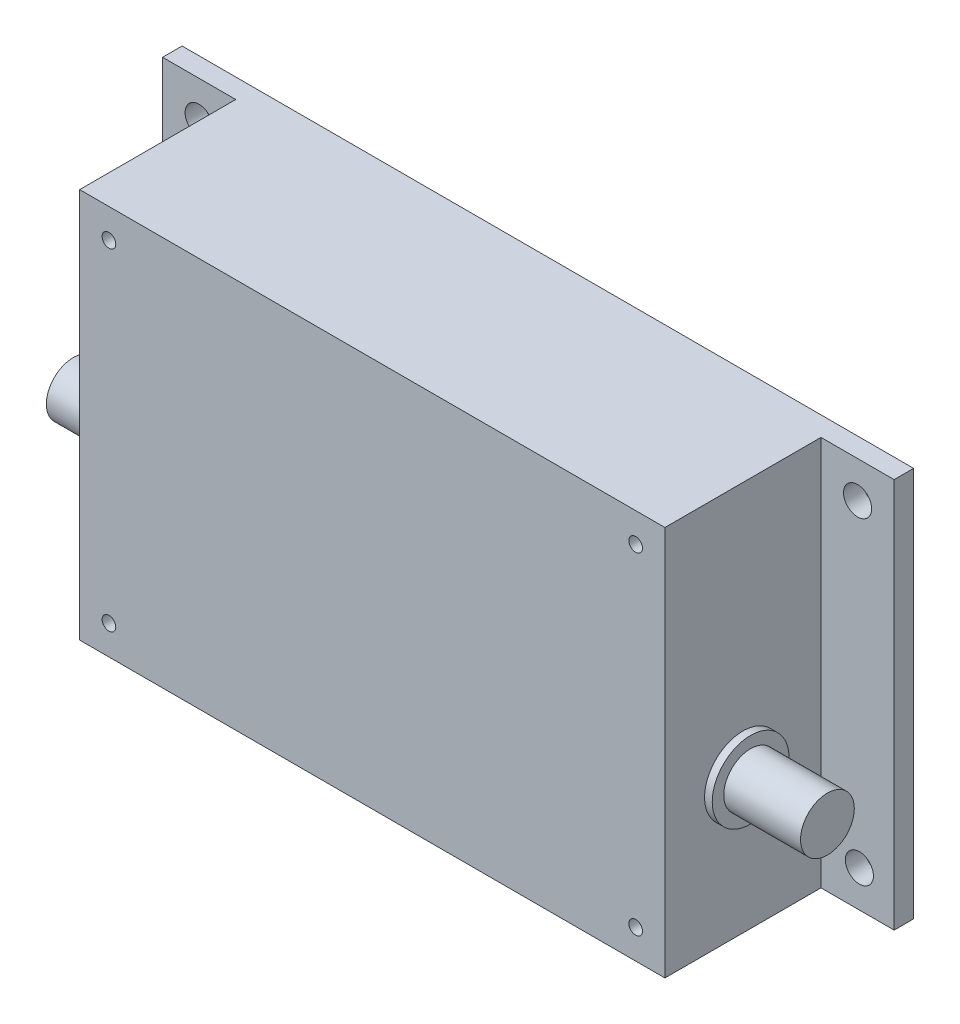
from build123d import *

# Parameters (mm, degrees)
SZKIC1_W                    = 95.25
SZKIC1_H                    = 50.8
SZKIC1_R                    = 1.83
DODANIE_WYCI_GNI_CIE1_DEPTH = 2.54
SZKIC2_W                    = 76.2
SZKIC2_H                    = 50.8
DODANIE_WYCI_GNI_CIE2_DEPTH = 20.32
OTW_R_50_0_07_1_D           = 1.778
OTW_R_50_0_07_1_DEPTH       = 5
OTW_R_50_0_07_1_TIP         = 0.53416509
SZKIC6_R                    = 3.5
DODANIE_WYCI_GNI_CIE3_DEPTH = 11
SZKIC7_R                    = 5
DODANIE_WYCI_GNI_CIE4_DEPTH = 1
DODANIE_WYCI_GNI_CIE5_START = 11
SZKIC8_R                    = 3.5
DODANIE_WYCI_GNI_CIE5_DEPTH = 11
DODANIE_WYCI_GNI_CIE6_START = 1
SZKIC9_R                    = 5
DODANIE_WYCI_GNI_CIE6_DEPTH = 1
SZKIC10_R                   = 0.5
DODANIE_WYCI_GNI_CIE7_DEPTH = 10
SZKIC12_R                   = 1.059326458
DODANIE_WYCI_GNI_CIE8_DEPTH = 1
SZKIC11_R                   = 4
DODANIE_WYCI_GNI_CIE9_DEPTH = 1


with BuildPart() as part:
    # Szkic1 → Dodanie-wyciągnięcie1 (new body)
    with BuildSketch(Plane.XY):
        with Locations((-3.430103099, 0.268410085)):
            Rectangle(SZKIC1_W, SZKIC1_H)
        with Locations((-46.060693789, -20.371589915)):
            Circle(SZKIC1_R, mode=Mode.SUBTRACT)
        with Locations((-46.295103099, 20.908410085)):
            Circle(SZKIC1_R, mode=Mode.SUBTRACT)
        with Locations((39.434896901, 20.908410085)):
            Circle(SZKIC1_R, mode=Mode.SUBTRACT)
        with Locations((39.669306211, -20.371589915)):
            Circle(SZKIC1_R, mode=Mode.SUBTRACT)
    extrude(amount=DODANIE_WYCI_GNI_CIE1_DEPTH)

    # Szkic2 → Dodanie-wyciągnięcie2 (add)
    with BuildSketch(Plane.XY.offset(2.54)):
        with Locations((-3.430103099, 0.268410085)):
            Rectangle(SZKIC2_W, SZKIC2_H)
    extrude(amount=DODANIE_WYCI_GNI_CIE2_DEPTH)

    # Otwór #50 (0.07)1
    with Locations(Plane.XY.offset(22.86)):
        with Locations((-37.720103099, 21.858410085), (30.859896901, 21.858410085), (30.859896901, -21.321589915), (-37.720103099, -21.321589915)):
            Hole(OTW_R_50_0_07_1_D / 2, depth=OTW_R_50_0_07_1_DEPTH)
            with Locations((0, 0, -(OTW_R_50_0_07_1_DEPTH + OTW_R_50_0_07_1_TIP / 2))):  # 118° drill point
                Cone(0, OTW_R_50_0_07_1_D / 2, OTW_R_50_0_07_1_TIP, mode=Mode.SUBTRACT)

    # Szkic6 → Dodanie-wyciągnięcie3 (add)
    with BuildSketch(Plane.ZY.offset(41.530103099)):
        with Locations(Location((12.7, -7.351589915, 0), (0, 0, 90))):
            Circle(SZKIC6_R)
    extrude(amount=DODANIE_WYCI_GNI_CIE3_DEPTH)

    # Szkic7 → Dodanie-wyciągnięcie4 (add)
    with BuildSketch(Plane.ZY.offset(41.530103099)):
        with Locations(Location((12.7, -7.351589915, 0), (0, 0, 90))):
            Circle(SZKIC7_R)
    extrude(amount=DODANIE_WYCI_GNI_CIE4_DEPTH)

    # Szkic8 → Dodanie-wyciągnięcie5 (add)
    with BuildSketch(Plane(origin=(34.669896901, 0, 0), x_dir=(0, 0, -1), z_dir=(1, 0, 0)).offset(DODANIE_WYCI_GNI_CIE5_START)):
        with Locations(Location((-12.7, -7.351589915, 0), (0, 0, 270))):
            Circle(SZKIC8_R)
    extrude(amount=-DODANIE_WYCI_GNI_CIE5_DEPTH)

    # Szkic9 → Dodanie-wyciągnięcie6 (add)
    with BuildSketch(Plane(origin=(34.669896901, 0, 0), x_dir=(0, 0, -1), z_dir=(1, 0, 0)).offset(DODANIE_WYCI_GNI_CIE6_START)):
        with Locations(Location((-12.7, -7.351589915, 0), (0, 0, 90))):
            Circle(SZKIC9_R)
    extrude(amount=-DODANIE_WYCI_GNI_CIE6_DEPTH)

    # Szkic10 → Dodanie-wyciągnięcie7 (add)
    with BuildSketch(Plane.ZY.offset(41.530103099)):
        with Locations(Location((10.16, 12.968410085, 0), (0, 0, 90))):
            Circle(SZKIC10_R)
    extrude(amount=DODANIE_WYCI_GNI_CIE7_DEPTH)

    # Szkic12 → Dodanie-wyciągnięcie8 (add)
    with BuildSketch(Plane.ZY.offset(51.530103099)):
        with Locations(Location((10.16, 12.968410085, 0), (0, 0, 270))):
            Circle(SZKIC12_R)
    extrude(amount=-DODANIE_WYCI_GNI_CIE8_DEPTH)

    # Szkic11 → Dodanie-wyciągnięcie9 (add)
    with BuildSketch(Plane.ZY.offset(41.530103099)):
        with Locations(Location((10.16, 12.968410085, 0), (0, 0, 90))):
            Circle(SZKIC11_R)
    extrude(amount=DODANIE_WYCI_GNI_CIE9_DEPTH)


solid = part.part
